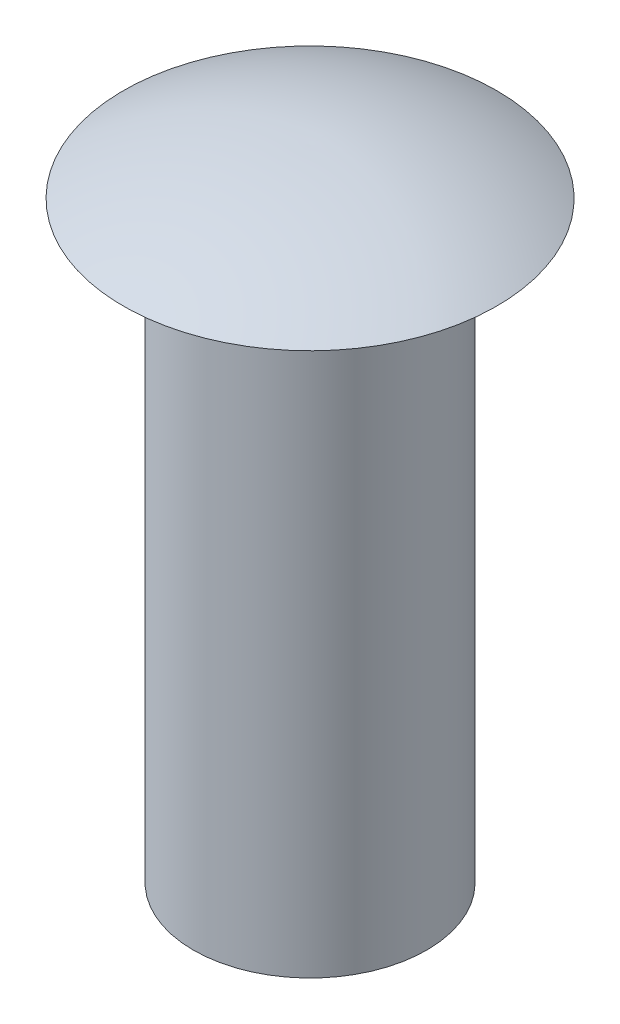
from build123d import *

# Parameters (mm, degrees)
SKETCH1_R           = 2.5
BOSS_EXTRUDE1_DEPTH = 12.7


with BuildPart() as part:
    # Sketch1 → Boss-Extrude1 (new body)
    with BuildSketch(Plane(origin=(0, 0, 0), x_dir=(1, 0, 0), z_dir=(0, 1, 0))):
        with Locations(Location((0, 0, 0), (0, 0, 270))):
            Circle(SKETCH1_R)
    extrude(amount=BOSS_EXTRUDE1_DEPTH)

    # Sketch2 → Revolve1 (revolve)
    with BuildSketch(Plane.XY):
        with BuildLine():
            Line((0, 12.7), (0, 13.7))
            ThreePointArc((0, 13.7), (2.065450055, 13.461800222), (4, 12.7))
            Line((4, 12.7), (0, 12.7))
        make_face()
    revolve(axis=Axis((0, 12.7, 0), (0, 1, 0)))


solid = part.part
